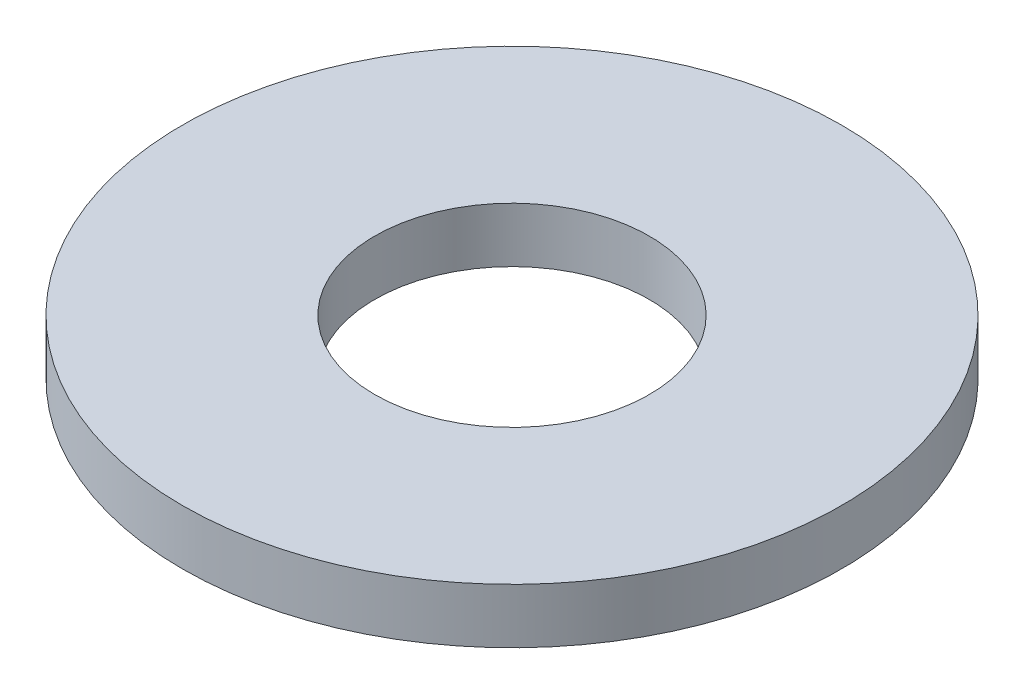
from build123d import *

# Parameters (mm, degrees)
SKETCH1_R           = 7.62
SKETCH1_R_2         = 3.175
BOSS_EXTRUDE1_DEPTH = 1.27


with BuildPart() as part:
    # Sketch1 → Boss-Extrude1 (new body)
    with BuildSketch(Plane(origin=(0, 0, 0), x_dir=(1, 0, 0), z_dir=(0, 1, 0))):
        with Locations(Location((0, 0, 0), (0, 0, 270))):
            Circle(SKETCH1_R)
        with Locations(Location((0, 0, 0), (0, 0, 270))):
            Circle(SKETCH1_R_2, mode=Mode.SUBTRACT)
    extrude(amount=BOSS_EXTRUDE1_DEPTH)


solid = part.part
